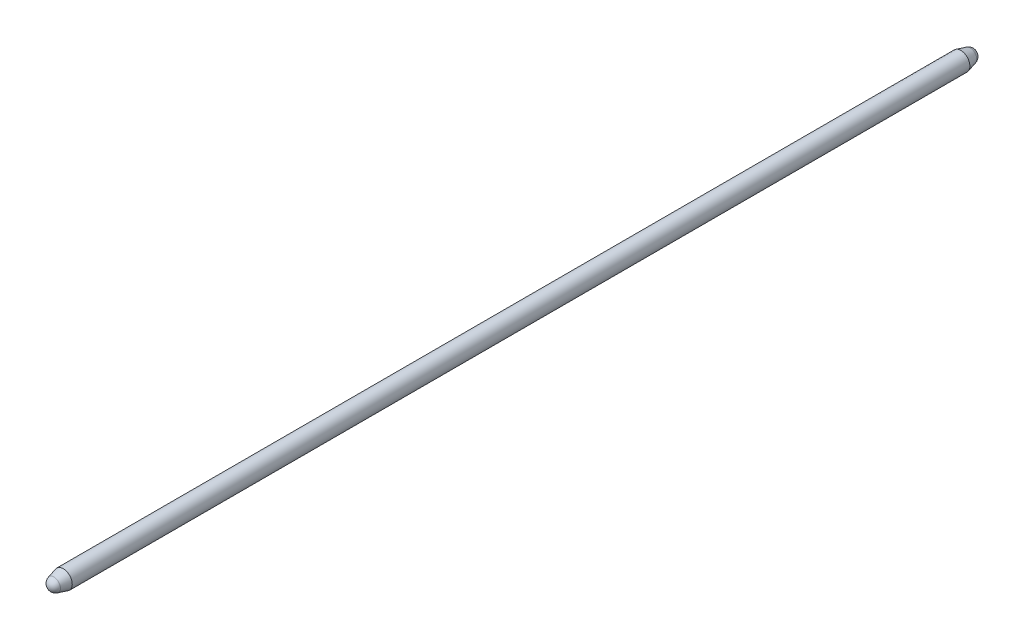
from build123d import *


with BuildPart() as part:
    # Sketch2 → Revolve1 (revolve)
    with BuildSketch(Plane(origin=(0, 0, 0), x_dir=(0, 0, -1), z_dir=(1, 0, 0))):
        with BuildLine():
            Line((1255.334291848, 25.4), (1281.455337206, 18.400886991))
            ThreePointArc((1281.455337206, 18.400886991), (1291.638215529, 11.596905223), (1295.574834397, 0))
            Line((1295.574834397, 0), (1255.334291848, 0))
            Line((1255.334291848, 0), (1255.334291848, 22.987))
            Line((1255.334291848, 22.987), (-1255.334291848, 22.987))
            Line((-1255.334291848, 22.987), (-1255.334291848, 0))
            Line((-1255.334291848, 0), (-1295.574834397, 0))
            ThreePointArc((-1295.574834397, 0), (-1291.638215529, 11.596905223), (-1281.455337206, 18.400886991))
            Line((-1281.455337206, 18.400886991), (-1255.334291848, 25.4))
            Line((-1255.334291848, 25.4), (1255.334291848, 25.4))
        make_face()
    revolve(axis=Axis((0, 0, -1295.574834397), (0, 0, 1)))


solid = part.part
